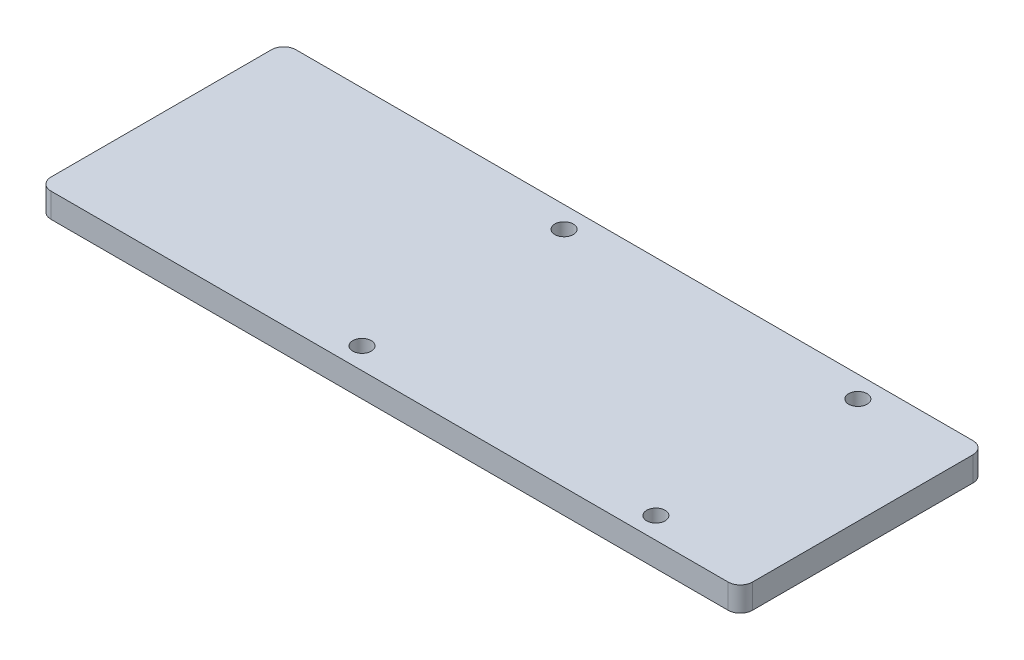
from build123d import *

# Parameters (mm, degrees)
SKETCH1_W           = 363.80000011
SKETCH1_H           = 127
BOSS_EXTRUDE1_DEPTH = 12.7
FILLET1_R           = 6.35
SKETCH2_R           = 4.7752
CUT_EXTRUDE1_DEPTH  = 194.083272243


with BuildPart() as part:
    # Sketch1 → Boss-Extrude1 (new body)
    with BuildSketch(Plane(origin=(0, 0, 0), x_dir=(1, 0, 0), z_dir=(0, 1, 0))):
        Rectangle(SKETCH1_W, SKETCH1_H)
    extrude(amount=BOSS_EXTRUDE1_DEPTH)

    # Fillet1
    fillet1_edges = [part.edges().sort_by_distance(p)[0] for p in [
        (181.900000055, 6.35, 63.5),
        (-181.900000055, 6.35, 63.5),
        (-181.900000055, 6.35, -63.5),
        (181.900000055, 6.35, -63.5),
    ]]
    fillet(fillet1_edges, radius=FILLET1_R)

    # Sketch2 → Cut-Extrude1 (cut, through all)
    with BuildSketch(Plane(origin=(0, 12.7, 0), x_dir=(1, 0, 0), z_dir=(0, 1, 0))):
        with Locations(Location((-25.4, 52.3748, 0), (0, 0, 270))):
            Circle(SKETCH2_R)
        with Locations(Location((-25.4, -52.3748, 0), (0, 0, 90))):
            Circle(SKETCH2_R)
        with Locations(Location((127, -52.3748, 0), (0, 0, 270))):
            Circle(SKETCH2_R)
        with Locations(Location((127, 52.3748, 0), (0, 0, 90))):
            Circle(SKETCH2_R)
    extrude(amount=-CUT_EXTRUDE1_DEPTH, mode=Mode.SUBTRACT)


solid = part.part
